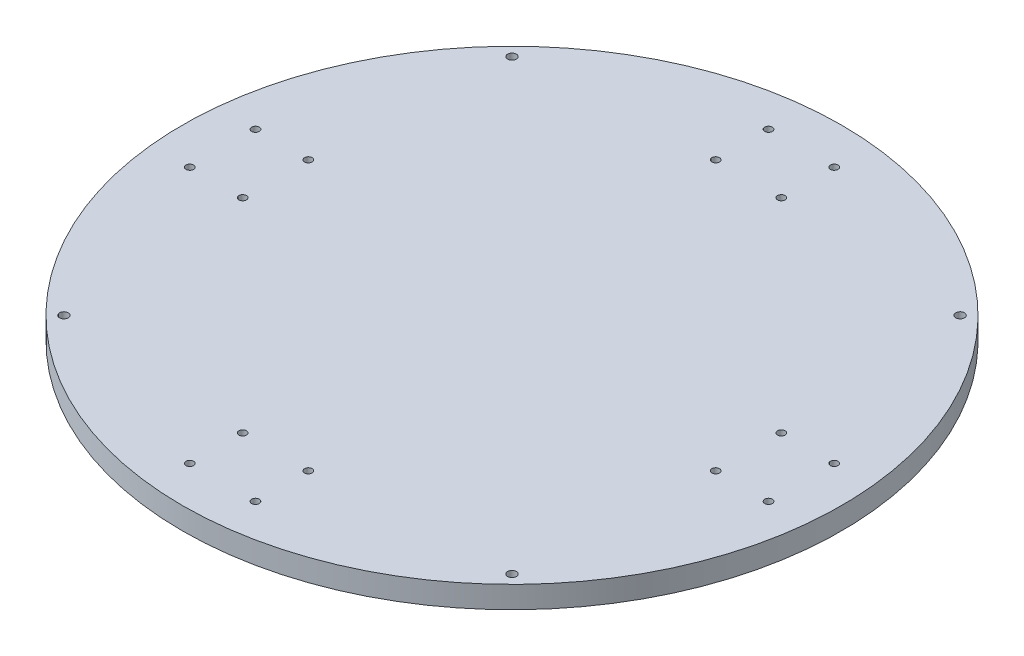
from build123d import *

# Parameters (mm, degrees)
SKETCH1_R           = 150
BOSS_EXTRUDE1_DEPTH = 10
SKETCH2_R           = 1.73
SKETCH2_R_2         = 2
CUT_EXTRUDE1_DEPTH  = 10


with BuildPart() as part:
    # Sketch1 → Boss-Extrude1 (new body)
    with BuildSketch(Plane(origin=(0, 0, 0), x_dir=(1, 0, 0), z_dir=(0, 1, 0))):
        with Locations(Location((0, 0, 0), (0, 0, 270))):
            Circle(SKETCH1_R)
    extrude(amount=BOSS_EXTRUDE1_DEPTH)

    # Sketch2 → Cut-Extrude1 (cut)
    with BuildSketch(Plane(origin=(0, 10, 0), x_dir=(1, 0, 0), z_dir=(0, 1, 0))):
        with Locations(Location((-14.945, 131.706442493, 0), (0, 0, 270))):
            Circle(SKETCH2_R)
        with Locations(Location((-14.945, 107.646442493, 0), (0, 0, 270))):
            Circle(SKETCH2_R)
        with Locations(Location((14.945, 107.646442493, 0), (0, 0, 90))):
            Circle(SKETCH2_R)
        with Locations(Location((14.945, 131.706442493, 0), (0, 0, 90))):
            Circle(SKETCH2_R)
        with Locations(Location((131.706442493, 14.945, 0), (0, 0, 270))):
            Circle(SKETCH2_R)
        with Locations(Location((131.706442493, -14.945, 0), (0, 0, 90))):
            Circle(SKETCH2_R)
        with Locations(Location((107.646442493, -14.945, 0), (0, 0, 90))):
            Circle(SKETCH2_R)
        with Locations(Location((107.646442493, 14.945, 0), (0, 0, 270))):
            Circle(SKETCH2_R)
        with Locations(Location((14.945, -131.706442493, 0), (0, 0, 270))):
            Circle(SKETCH2_R)
        with Locations(Location((-14.945, -131.706442493, 0), (0, 0, 90))):
            Circle(SKETCH2_R)
        with Locations(Location((-14.945, -107.646442493, 0), (0, 0, 90))):
            Circle(SKETCH2_R)
        with Locations(Location((14.945, -107.646442493, 0), (0, 0, 270))):
            Circle(SKETCH2_R)
        with Locations(Location((-131.706442493, -14.945, 0), (0, 0, 270))):
            Circle(SKETCH2_R)
        with Locations(Location((-131.706442493, 14.945, 0), (0, 0, 90))):
            Circle(SKETCH2_R)
        with Locations(Location((-107.646442493, 14.945, 0), (0, 0, 90))):
            Circle(SKETCH2_R)
        with Locations(Location((-107.646442493, -14.945, 0), (0, 0, 270))):
            Circle(SKETCH2_R)
        with Locations(Location((101.974532959, 101.974532959, 0), (0, 0, 270))):
            Circle(SKETCH2_R_2)
        with Locations(Location((101.974532959, -101.974532959, 0), (0, 0, 270))):
            Circle(SKETCH2_R_2)
        with Locations(Location((-101.974532959, -101.974532959, 0), (0, 0, 270))):
            Circle(SKETCH2_R_2)
        with Locations(Location((-101.974532959, 101.974532959, 0), (0, 0, 270))):
            Circle(SKETCH2_R_2)
    extrude(amount=-CUT_EXTRUDE1_DEPTH, mode=Mode.SUBTRACT)


solid = part.part
